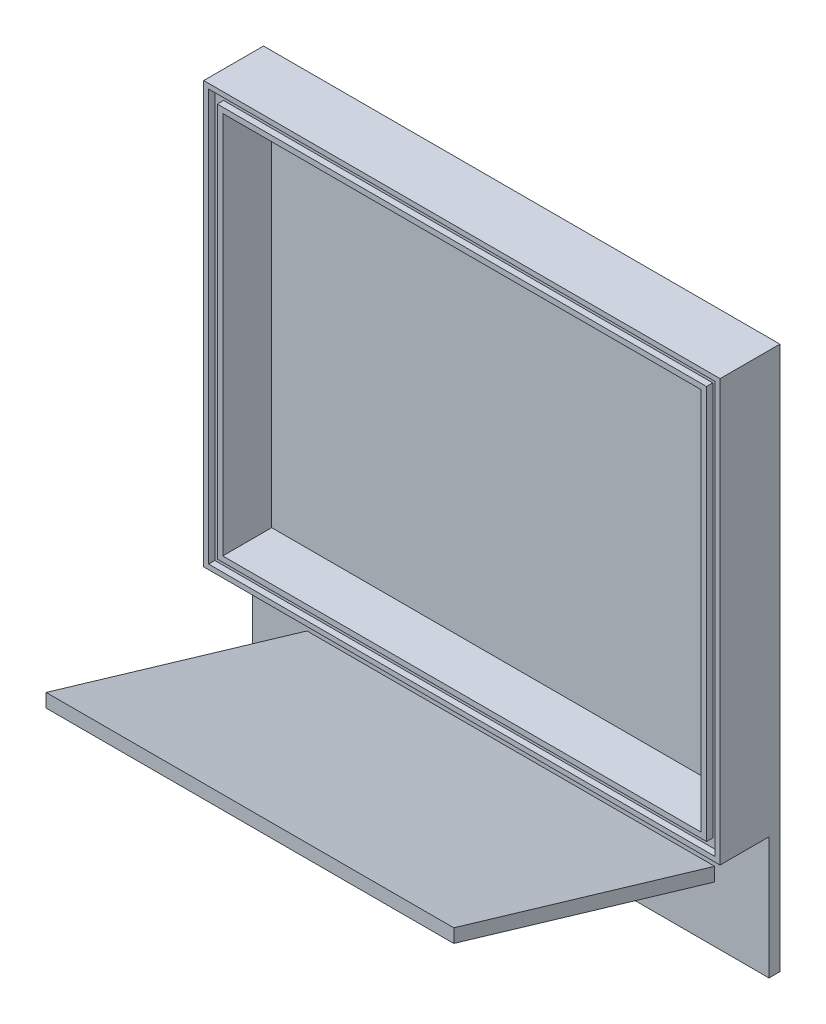
from build123d import *

# Parameters (mm, degrees)
F_190_X_200_TRAY_FLOOR_SKETCH_W                  = 190
F_190_X_200_TRAY_FLOOR_SKETCH_H                  = 200
F_4_MM_TRAY_FLOOR_DEPTH                          = 4
ELECTRONICS_COMPARTMENT_WALL_SKETCH_W            = 190
ELECTRONICS_COMPARTMENT_WALL_SKETCH_H            = 155
ELECTRONICS_COMPARTMENT_WALL_SKETCH_W_2          = 176
ELECTRONICS_COMPARTMENT_WALL_SKETCH_H_2          = 141
F_22_MM_PERIMETER_WALLS_DEPTH                    = 22
F_3_2_START                                      = 22
F_3_MM_CORD_GASKET_GROOVE_SKETCH_W               = 186.4
F_3_MM_CORD_GASKET_GROOVE_SKETCH_H               = 151.4
F_3_MM_CORD_GASKET_GROOVE_SKETCH_W_2             = 180
F_3_MM_CORD_GASKET_GROOVE_SKETCH_H_2             = 145
F_3_2_X_2_3_MM_PERIMETER_GASKET_GROOVE_DEPTH     = 2.3
F_150_MM_WIDE_ANGLED_DISPLAY_BULKHEAD_DEPTH      = 75
F_150_MM_WIDE_ANGLED_DISPLAY_BULKHEAD_DEPTH_BACK = 75


with BuildPart() as part:
    # 190 x 200 Tray Floor Sketch → 4 mm Tray Floor (new body)
    with BuildSketch(Plane.XY):
        with Locations((0, 100)):
            Rectangle(F_190_X_200_TRAY_FLOOR_SKETCH_W, F_190_X_200_TRAY_FLOOR_SKETCH_H)
    extrude(amount=F_4_MM_TRAY_FLOOR_DEPTH)

    # Electronics Compartment Wall Sketch → 22 mm Perimeter Walls (add)
    with BuildSketch(Plane.XY):
        with Locations((0, 122.5)):
            Rectangle(ELECTRONICS_COMPARTMENT_WALL_SKETCH_W, ELECTRONICS_COMPARTMENT_WALL_SKETCH_H)
        with Locations((0, 122.5)):
            Rectangle(ELECTRONICS_COMPARTMENT_WALL_SKETCH_W_2, ELECTRONICS_COMPARTMENT_WALL_SKETCH_H_2, mode=Mode.SUBTRACT)
    extrude(amount=F_22_MM_PERIMETER_WALLS_DEPTH)

    # 3 mm Cord Gasket Groove Sketch → 3.2 x 2.3 mm Perimeter Gasket Groove (cut)
    with BuildSketch(Plane.XY.offset(F_3_2_START)):
        with Locations((0, 122.5)):
            Rectangle(F_3_MM_CORD_GASKET_GROOVE_SKETCH_W, F_3_MM_CORD_GASKET_GROOVE_SKETCH_H)
        with Locations((0, 122.5)):
            Rectangle(F_3_MM_CORD_GASKET_GROOVE_SKETCH_W_2, F_3_MM_CORD_GASKET_GROOVE_SKETCH_H_2, mode=Mode.SUBTRACT)
    extrude(amount=-F_3_2_X_2_3_MM_PERIMETER_GASKET_GROOVE_DEPTH, mode=Mode.SUBTRACT)

    # Angled Display Bulkhead Side Profile → 150 mm Wide Angled Display Bulkhead (add, two sides: drawn at the far end of the back side and taken through both)
    with BuildSketch(Plane(origin=(0, 0, 0), x_dir=(0, 0, -1), z_dir=(1, 0, 0)).offset(-F_150_MM_WIDE_ANGLED_DISPLAY_BULKHEAD_DEPTH_BACK)):
        Polygon((-2, 20), (-2, 25), (-100, 54), (-100, 49), align=None)
    extrude(amount=F_150_MM_WIDE_ANGLED_DISPLAY_BULKHEAD_DEPTH + F_150_MM_WIDE_ANGLED_DISPLAY_BULKHEAD_DEPTH_BACK)


solid = part.part
